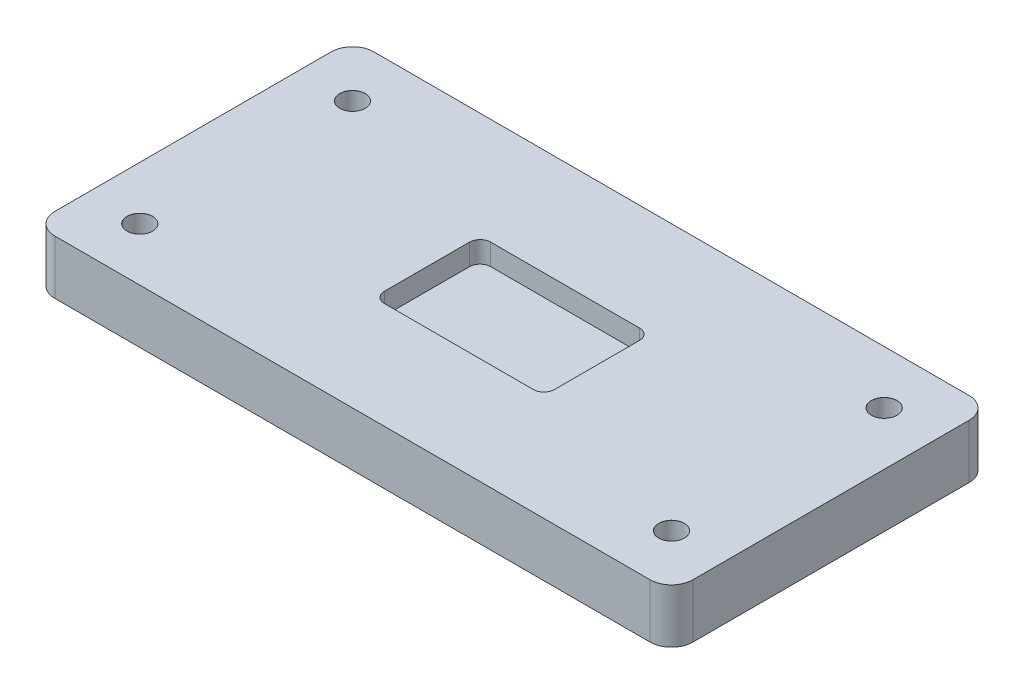
from build123d import *

# Parameters (mm, degrees)
BOSS_EXTRUDE1_DEPTH                  = 25.4
SKETCH4_W                            = 80
SKETCH4_H                            = 50
CUT_EXTRUDE1_DEPTH                   = 10
FILLET1_R                            = 5
F_12_0_12_DIAMETER_HOLE1_D           = 12
F_12_0_12_DIAMETER_HOLE1_CSINK_D     = 12.05
F_12_0_12_DIAMETER_HOLE1_CSINK_ANGLE = 100


with BuildPart() as part:
    # Sketch1 → Boss-Extrude1 (new body)
    with BuildSketch(Plane(origin=(0, 0, 0), x_dir=(1, 0, 0), z_dir=(0, 1, 0))):
        with BuildLine():
            Line((-140, 75), (140, 75))
            ThreePointArc((140, 75), (147.071067812, 72.071067812), (150, 65))
            Line((150, 65), (150, -65))
            ThreePointArc((150, -65), (147.071067812, -72.071067812), (140, -75))
            Line((140, -75), (-140, -75))
            ThreePointArc((-140, -75), (-147.071067812, -72.071067812), (-150, -65))
            Line((-150, -65), (-150, 65))
            ThreePointArc((-150, 65), (-147.071067812, 72.071067812), (-140, 75))
        make_face()
    extrude(amount=BOSS_EXTRUDE1_DEPTH)

    # Sketch4 → Cut-Extrude1 (cut)
    with BuildSketch(Plane(origin=(0, 25.4, 0), x_dir=(1, 0, 0), z_dir=(0, 1, 0))):
        Rectangle(SKETCH4_W, SKETCH4_H)
    extrude(amount=-CUT_EXTRUDE1_DEPTH, mode=Mode.SUBTRACT)

    # Fillet1
    fillet1_edges = [part.edges().sort_by_distance(p)[0] for p in [
        (-40, 20.4, 25),
        (40, 20.4, 25),
        (-40, 20.4, -25),
        (40, 20.4, -25),
    ]]
    fillet(fillet1_edges, radius=FILLET1_R)

    # Ø12.0 (12) Diameter Hole1 (through all)
    with Locations(Plane(origin=(0, 25.4, 0), x_dir=(1, 0, 0), z_dir=(0, 1, 0))):
        with Locations((-125, 50), (125, 50), (125, -50), (-125, -50)):
            CounterSinkHole(F_12_0_12_DIAMETER_HOLE1_D / 2, F_12_0_12_DIAMETER_HOLE1_CSINK_D / 2, counter_sink_angle=F_12_0_12_DIAMETER_HOLE1_CSINK_ANGLE)


solid = part.part
